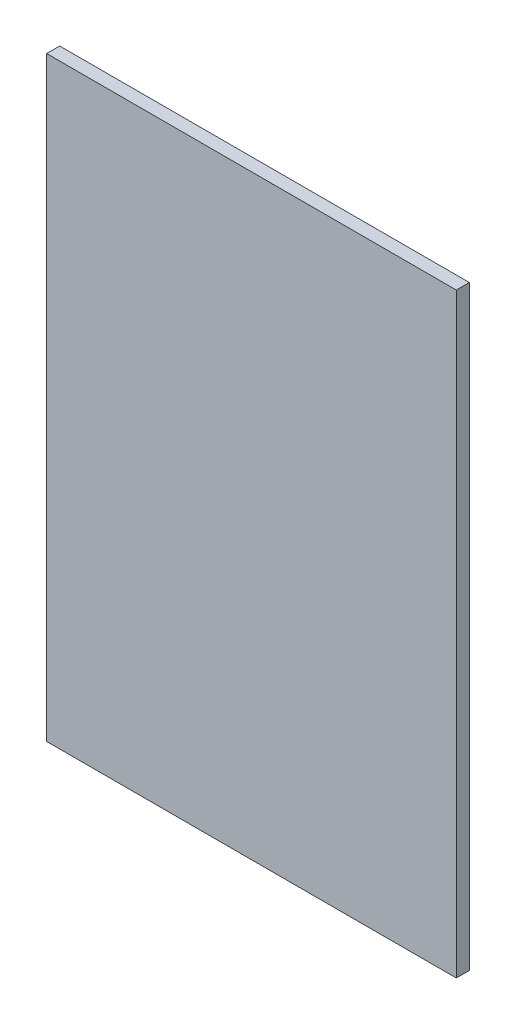
from build123d import *

# Parameters (mm, degrees)
SKETCH1_W           = 558.8
SKETCH1_H           = 812.8
BOSS_EXTRUDE1_DEPTH = 17.78


with BuildPart() as part:
    # Sketch1 → Boss-Extrude1 (new body)
    with BuildSketch(Plane.XY):
        with Locations((279.4, 406.4)):
            Rectangle(SKETCH1_W, SKETCH1_H)
    extrude(amount=BOSS_EXTRUDE1_DEPTH)


solid = part.part
